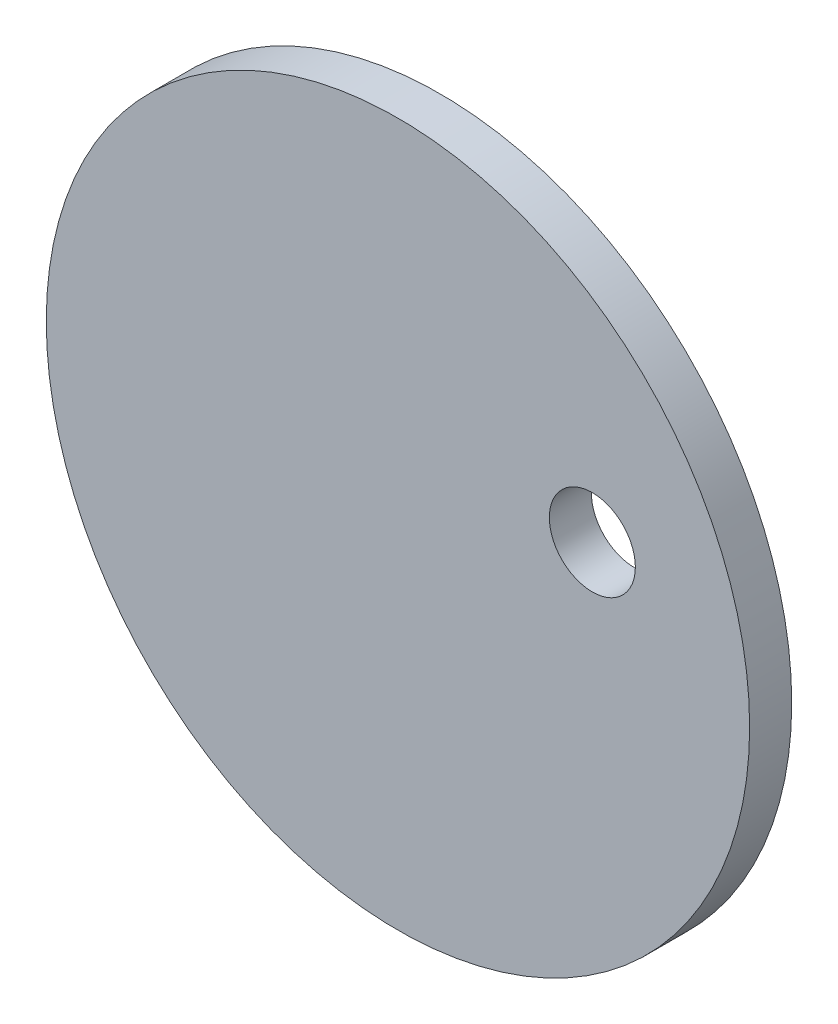
from build123d import *

# Parameters (mm, degrees)
SKETCH1_R      = 76.414321236
SKETCH1_R_2    = 9.347426307
EXTRUDE1_DEPTH = 9.144


with BuildPart() as part:
    # Sketch1 → Extrude1 (new body)
    with BuildSketch(Plane.XY):
        Circle(SKETCH1_R)
        with Locations((42.234252899, 17.704783599)):
            Circle(SKETCH1_R_2, mode=Mode.SUBTRACT)
    extrude(amount=-EXTRUDE1_DEPTH)


solid = part.part
